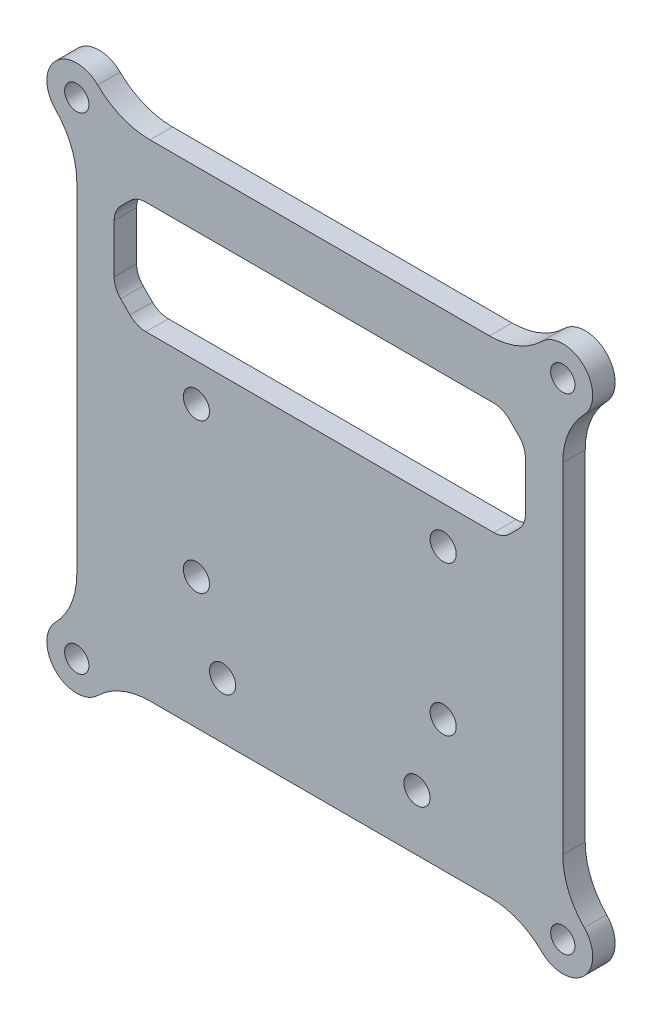
from build123d import *

# Parameters (mm, degrees)
SKETCH_1_R          = 1.625
EXTRUDE_1_DEPTH     = 3
FILLET_1_R          = 10
SKETCH_2_R          = 1.75
CUT_EXTRUDE_1_DEPTH = 10
SKETCH_4_R          = 1.75
CUT_EXTRUDE_2_DEPTH = 10
SKETCH_5_R          = 1.75
CUT_EXTRUDE_3_DEPTH = 10
CUT_EXTRUDE_4_DEPTH = 10
FILLET_2_R          = 3


with BuildPart() as part:
    # Эскиз1 → Бобышка-Вытянуть1 (new body)
    with BuildSketch(Plane.XY):
        with BuildLine():
            ThreePointArc((-32.5, -28.5), (-35.328427125, -35.328427125), (-28.5, -32.5))
            Line((-28.5, -32.5), (28.5, -32.5))
            ThreePointArc((28.5, -32.5), (35.328427125, -35.328427125), (32.5, -28.5))
            Line((32.5, -28.5), (32.5, 28.5))
            ThreePointArc((32.5, 28.5), (35.328427125, 35.328427125), (28.5, 32.5))
            Line((28.5, 32.5), (-28.5, 32.5))
            ThreePointArc((-28.5, 32.5), (-35.328427125, 35.328427125), (-32.5, 28.5))
            Line((-32.5, 28.5), (-32.5, -28.5))
        make_face()
        with Locations((-32.5, -32.5)):
            Circle(SKETCH_1_R, mode=Mode.SUBTRACT)
        with Locations((32.5, 32.5)):
            Circle(SKETCH_1_R, mode=Mode.SUBTRACT)
        with Locations((-32.5, 32.5)):
            Circle(SKETCH_1_R, mode=Mode.SUBTRACT)
        with Locations((32.5, -32.5)):
            Circle(SKETCH_1_R, mode=Mode.SUBTRACT)
    extrude(amount=EXTRUDE_1_DEPTH)

    # Скругление1
    fillet_1_edges = [part.edges().sort_by_distance(p)[0] for p in [
        (-32.5, -28.5, 1.5),
        (-32.5, 28.5, 1.5),
        (-28.5, 32.5, 1.5),
        (28.5, 32.5, 1.5),
        (32.5, 28.5, 1.5),
        (32.5, -28.5, 1.5),
        (28.5, -32.5, 1.5),
        (-28.5, -32.5, 1.5),
    ]]
    fillet(fillet_1_edges, radius=FILLET_1_R)

    # Эскиз2 → Вырез-Вытянуть1 (cut)
    with BuildSketch(Plane.XY.offset(3)):
        with Locations((-13, -25)):
            Circle(SKETCH_2_R)
        with Locations((13, -25)):
            Circle(SKETCH_2_R)
    extrude(amount=-CUT_EXTRUDE_1_DEPTH, mode=Mode.SUBTRACT)

    # Эскиз4 → Вырез-Вытянуть2 (cut)
    with BuildSketch(Plane.XY.offset(3)):
        with Locations((-16.5, -15)):
            Circle(SKETCH_4_R)
        with Locations((16.5, -15)):
            Circle(SKETCH_4_R)
    extrude(amount=-CUT_EXTRUDE_2_DEPTH, mode=Mode.SUBTRACT)

    # Эскиз5 → Вырез-Вытянуть3 (cut)
    with BuildSketch(Plane.XY.offset(3)):
        with Locations((-16.5, 5)):
            Circle(SKETCH_5_R)
        with Locations((16.5, 5)):
            Circle(SKETCH_5_R)
    extrude(amount=-CUT_EXTRUDE_3_DEPTH, mode=Mode.SUBTRACT)

    # Эскиз7 → Вырез-Вытянуть4 (cut)
    with BuildSketch(Plane.XY.offset(3)):
        Polygon((-24.5, 25), (24.5, 25), (27.5, 22), (27.5, 13), (24.5, 10), (-24.5, 10), (-27.5, 13), (-27.5, 22), align=None)
    extrude(amount=-CUT_EXTRUDE_4_DEPTH, mode=Mode.SUBTRACT)

    # Скругление2
    fillet_2_edges = [part.edges().sort_by_distance(p)[0] for p in [
        (-27.5, 22, 1.5),
        (-24.5, 25, 1.5),
        (24.5, 25, 1.5),
        (27.5, 22, 1.5),
        (27.5, 13, 1.5),
        (24.5, 10, 1.5),
        (-24.5, 10, 1.5),
        (-27.5, 13, 1.5),
    ]]
    fillet(fillet_2_edges, radius=FILLET_2_R)


solid = part.part
